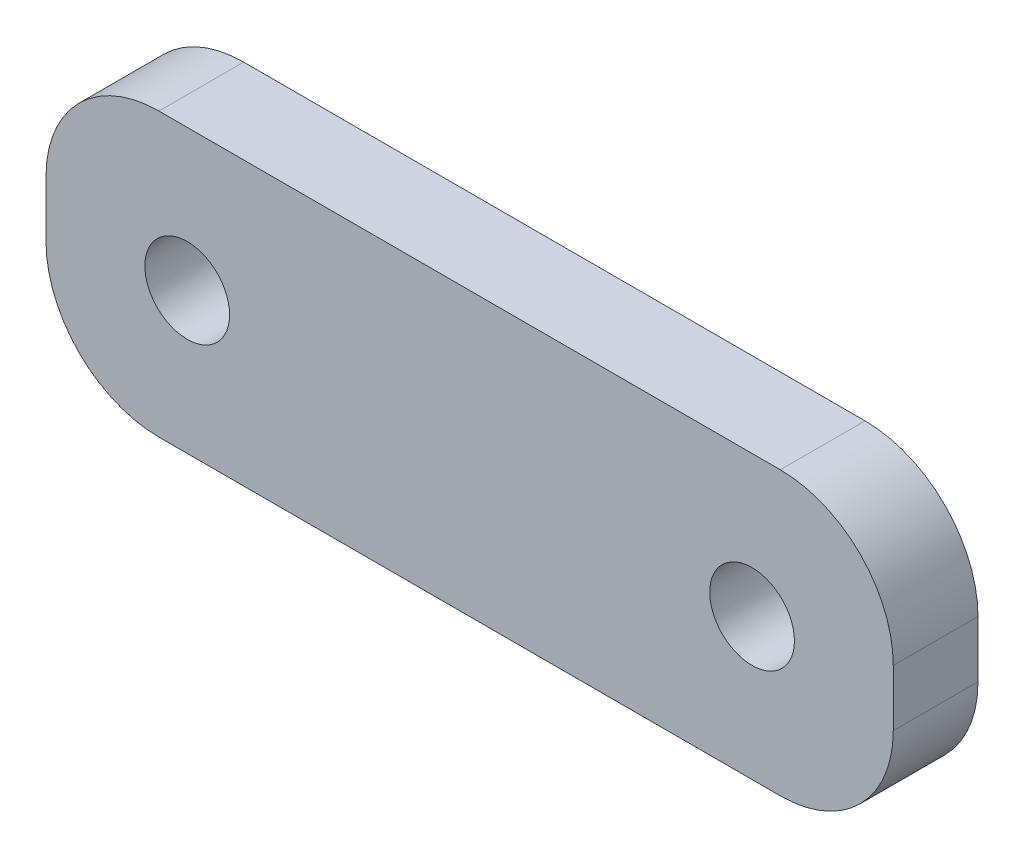
from build123d import *

# Parameters (mm, degrees)
SKETCH_1_W          = 30
SKETCH_1_H          = 10
EXTRUDE_1_DEPTH     = 3
SKETCH_2_R          = 1.5
CUT_EXTRUDE_1_DEPTH = 3
FILLET_1_R          = 4


with BuildPart() as part:
    # 草图1 → 凸台-拉伸1 (new body)
    with BuildSketch(Plane.XY):
        Rectangle(SKETCH_1_W, SKETCH_1_H)
    extrude(amount=EXTRUDE_1_DEPTH)

    # 草图2 → 切除-拉伸1 (cut)
    with BuildSketch(Plane.XY.offset(3)):
        with Locations((10, 0)):
            Circle(SKETCH_2_R)
        with Locations((-10, 0)):
            Circle(SKETCH_2_R)
    extrude(amount=-CUT_EXTRUDE_1_DEPTH, mode=Mode.SUBTRACT)

    # 圆角1
    fillet_1_edges = [part.edges().sort_by_distance(p)[0] for p in [
        (-15, 5, 1.5),
        (15, 5, 1.5),
        (15, -5, 1.5),
        (-15, -5, 1.5),
    ]]
    fillet(fillet_1_edges, radius=FILLET_1_R)


solid = part.part
